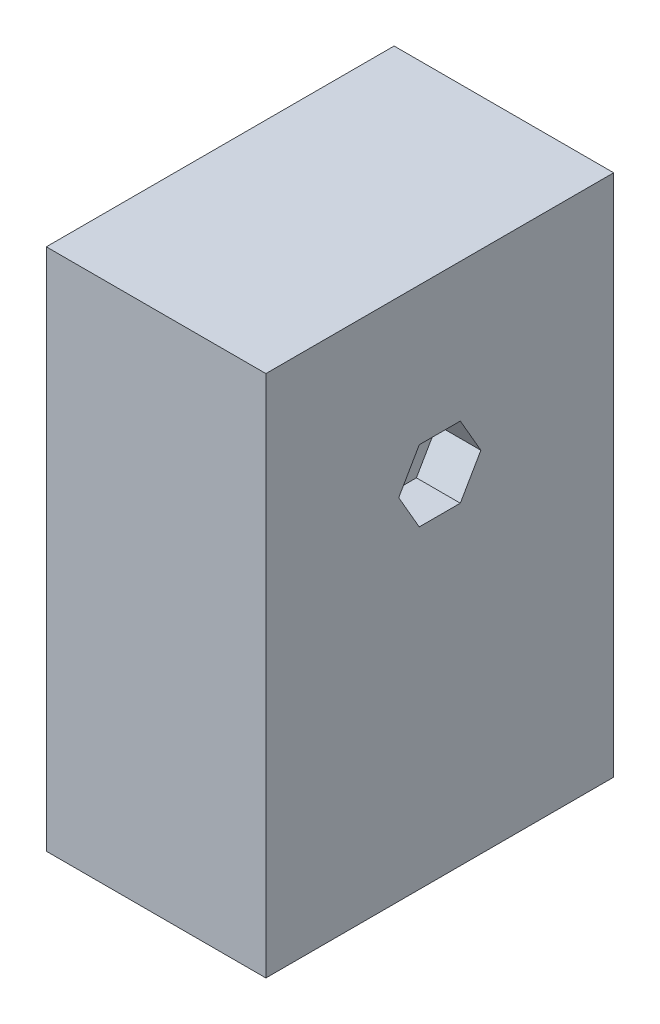
from build123d import *

# Parameters (mm, degrees)
SKETCH1_W               = 39.6
SKETCH1_H               = 59.6
BOSS_EXTRUDE1_DEPTH     = 25
CUT_EXTRUDE1_DEPTH      = 5
CUT_EXTRUDE2_DEPTH      = 44.647222134
CUT_EXTRUDE2_DEPTH_BACK = 44.647222134
SKETCH3_R               = 2.75
CUT_EXTRUDE4_START      = 25
CUT_EXTRUDE4_DEPTH      = 5


with BuildPart() as part:
    # Sketch1 → Boss-Extrude1 (new body)
    with BuildSketch(Plane(origin=(0, 0, 0), x_dir=(0, 0, -1), z_dir=(1, 0, 0))):
        Rectangle(SKETCH1_W, SKETCH1_H)
    extrude(amount=BOSS_EXTRUDE1_DEPTH)

    # Sketch2 → Cut-Extrude1 (cut)
    with BuildSketch(Plane(origin=(0, 0, 0), x_dir=(0, 0, -1), z_dir=(1, 0, 0))):
        Polygon((4.67653718, 10), (2.33826859, 14.05), (-2.33826859, 14.05), (-4.67653718, 10), (-2.33826859, 5.95), (2.33826859, 5.95), align=None)
    extrude(amount=CUT_EXTRUDE1_DEPTH, mode=Mode.SUBTRACT)

    # Sketch3 → Cut-Extrude2 (cut, two sides: drawn at the far end of the back side and taken through both)
    with BuildSketch(Plane(origin=(0, 0, 0), x_dir=(0, 0, -1), z_dir=(1, 0, 0)).offset(-CUT_EXTRUDE2_DEPTH_BACK)):
        with Locations((0, 10)):
            Circle(SKETCH3_R)
    extrude(amount=CUT_EXTRUDE2_DEPTH + CUT_EXTRUDE2_DEPTH_BACK, mode=Mode.SUBTRACT)

    # Sketch2<2> → Cut-Extrude4 (cut)
    with BuildSketch(Plane(origin=(0, 0, 0), x_dir=(0, 0, -1), z_dir=(1, 0, 0)).offset(CUT_EXTRUDE4_START)):
        Polygon((4.67653718, 10), (2.33826859, 14.05), (-2.33826859, 14.05), (-4.67653718, 10), (-2.33826859, 5.95), (2.33826859, 5.95), align=None)
    extrude(amount=-CUT_EXTRUDE4_DEPTH, mode=Mode.SUBTRACT)


solid = part.part
